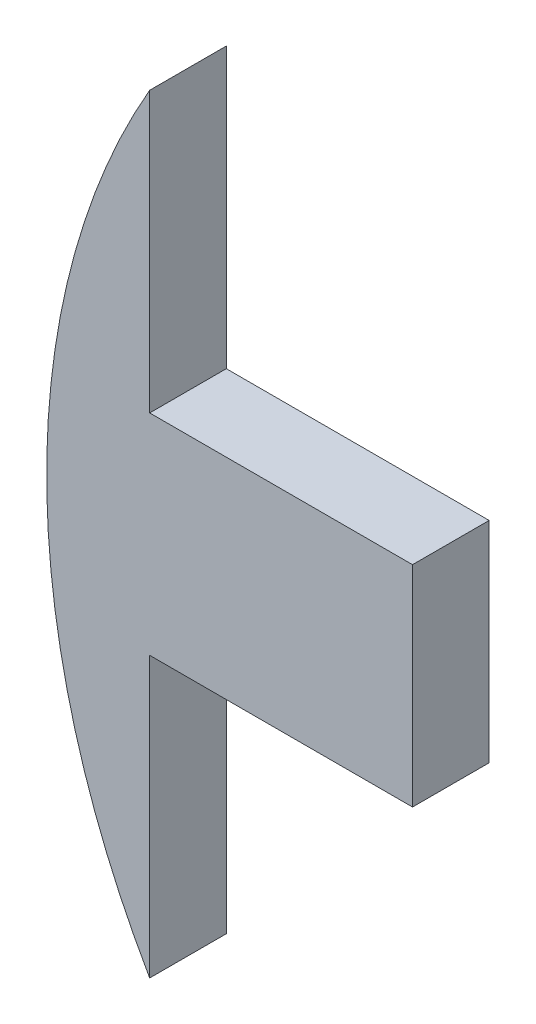
from build123d import *

# Parameters (mm, degrees)
BOSS_EXTRUDE2_DEPTH = 3.03


with BuildPart() as part:
    # Sketch4 → Boss-Extrude2 (new body)
    with BuildSketch(Plane.XY):
        with BuildLine():
            Line((-10.547054114, 19.169106214), (-10.547054114, 8.119106214))
            Line((-10.547054114, 8.119106214), (-0.154749269, 8.119106214))
            Line((-0.154749269, 8.119106214), (-0.154749269, -0.180893786))
            Line((-0.154749269, -0.180893786), (-10.547054114, -0.180893786))
            Line((-10.547054114, -0.180893786), (-10.547054114, -11.230893786))
            ThreePointArc((-10.547054114, -11.230893786), (-14.619881839, 3.969106214), (-10.547054114, 19.169106214))
        make_face()
    extrude(amount=BOSS_EXTRUDE2_DEPTH)


solid = part.part
